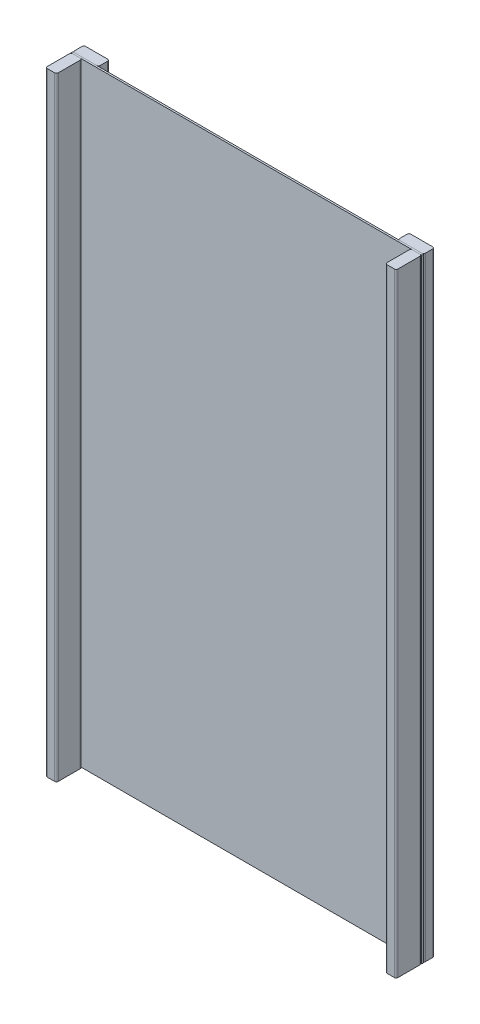
from build123d import *

# Parameters (mm, degrees)
SKETCH1_W             = 1219.2
SKETCH1_H             = 2133.6
BOSS_EXTRUDE1_DEPTH   = 6.35
BOSS_EXTRUDE2_DEPTH   = 2133.6
BOSS_EXTRUDE2_2_DEPTH = 2133.6
BOSS_EXTRUDE3_DEPTH   = 2133.6
BOSS_EXTRUDE3_2_DEPTH = 2133.6


with BuildPart() as part:
    # Sketch1 → Boss-Extrude1 (new body)
    with BuildSketch(Plane.XY):
        with Locations((0, 1066.8)):
            Rectangle(SKETCH1_W, SKETCH1_H)
    extrude(amount=BOSS_EXTRUDE1_DEPTH)


with BuildPart() as body_2:
    # Sketch2 → Boss-Extrude2 (new body)
    with BuildSketch(Plane(origin=(0, 0, 0), x_dir=(1, 0, 0), z_dir=(0, 1, 0))):
        with BuildLine():
            Line((603.25, -6.35), (577.85, -6.35))
            ThreePointArc((577.85, -6.35), (573.359871939, -8.209871939), (571.5, -12.7))
            Line((571.5, -12.7), (571.5, -88.9))
            ThreePointArc((571.5, -88.9), (573.359871939, -93.390128061), (577.85, -95.25))
            Line((577.85, -95.25), (603.25, -95.25))
            ThreePointArc((603.25, -95.25), (607.740128061, -93.390128061), (609.6, -88.9))
            Line((609.6, -88.9), (609.6, -12.7))
            ThreePointArc((609.6, -12.7), (607.740128061, -8.209871939), (603.25, -6.35))
        make_face()
    extrude(amount=BOSS_EXTRUDE2_DEPTH)


with BuildPart() as body_3:
    # Sketch2 → Boss-Extrude2 2 (new body)
    with BuildSketch(Plane(origin=(0, 0, 0), x_dir=(1, 0, 0), z_dir=(0, 1, 0))):
        with BuildLine():
            Line((-603.25, -6.35), (-577.85, -6.35))
            ThreePointArc((-577.85, -6.35), (-573.359871939, -8.209871939), (-571.5, -12.7))
            Line((-571.5, -12.7), (-571.5, -88.9))
            ThreePointArc((-571.5, -88.9), (-573.359871939, -93.390128061), (-577.85, -95.25))
            Line((-577.85, -95.25), (-603.25, -95.25))
            ThreePointArc((-603.25, -95.25), (-607.740128061, -93.390128061), (-609.6, -88.9))
            Line((-609.6, -88.9), (-609.6, -12.7))
            ThreePointArc((-609.6, -12.7), (-607.740128061, -8.209871939), (-603.25, -6.35))
        make_face()
    extrude(amount=BOSS_EXTRUDE2_2_DEPTH)


with BuildPart() as body_4:
    # Sketch3 → Boss-Extrude3 (new body)
    with BuildSketch(Plane(origin=(0, 0, 0), x_dir=(1, 0, 0), z_dir=(0, 1, 0))):
        with BuildLine():
            Line((603.25, 0), (527.05, 0))
            ThreePointArc((527.05, 0), (522.559871939, 1.859871939), (520.7, 6.35))
            Line((520.7, 6.35), (520.7, 31.75))
            ThreePointArc((520.7, 31.75), (522.559871939, 36.240128061), (527.05, 38.1))
            Line((527.05, 38.1), (603.25, 38.1))
            ThreePointArc((603.25, 38.1), (607.740128061, 36.240128061), (609.6, 31.75))
            Line((609.6, 31.75), (609.6, 6.35))
            ThreePointArc((609.6, 6.35), (607.740128061, 1.859871939), (603.25, 0))
        make_face()
    extrude(amount=BOSS_EXTRUDE3_DEPTH)


with BuildPart() as body_5:
    # Sketch3 → Boss-Extrude3 2 (new body)
    with BuildSketch(Plane(origin=(0, 0, 0), x_dir=(1, 0, 0), z_dir=(0, 1, 0))):
        with BuildLine():
            Line((-603.25, 0), (-527.05, 0))
            ThreePointArc((-527.05, 0), (-522.559871939, 1.859871939), (-520.7, 6.35))
            Line((-520.7, 6.35), (-520.7, 31.75))
            ThreePointArc((-520.7, 31.75), (-522.559871939, 36.240128061), (-527.05, 38.1))
            Line((-527.05, 38.1), (-603.25, 38.1))
            ThreePointArc((-603.25, 38.1), (-607.740128061, 36.240128061), (-609.6, 31.75))
            Line((-609.6, 31.75), (-609.6, 6.35))
            ThreePointArc((-609.6, 6.35), (-607.740128061, 1.859871939), (-603.25, 0))
        make_face()
    extrude(amount=BOSS_EXTRUDE3_2_DEPTH)


solid = Compound([part.part, body_2.part, body_3.part, body_4.part, body_5.part])
